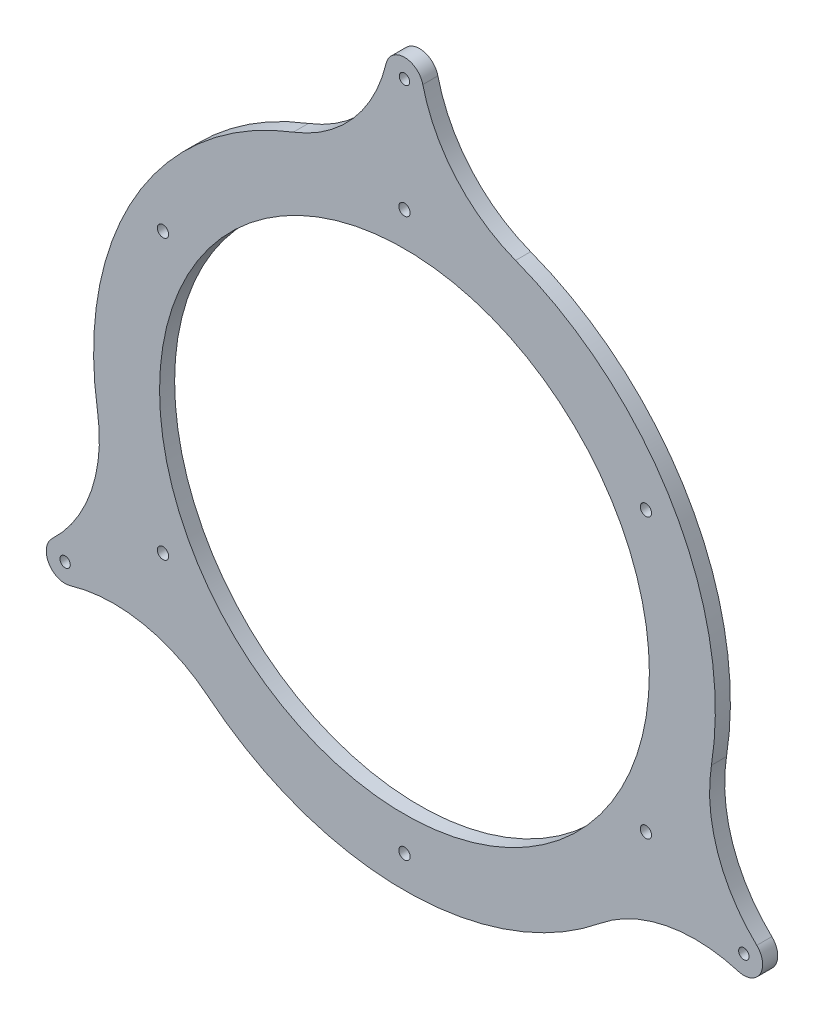
from build123d import *

# Parameters (mm, degrees)
SKETCH1_R           = 1.375
BOSS_EXTRUDE1_DEPTH = 4
SKETCH3_R           = 1.5
SKETCH3_R_2         = 65
CUT_EXTRUDE1_DEPTH  = 145.688169592


with BuildPart() as part:
    # Sketch1 → Boss-Extrude1 (new body)
    with BuildSketch(Plane.XY):
        with BuildLine():
            ThreePointArc((-29.484078319, 77.051535518), (-71.447095812, 41.25), (-81.470626319, -12.991806928))
            ThreePointArc((-81.470626319, -12.991806928), (-83.101535217, -32.169647267), (-93.500519111, -48.365651648))
            ThreePointArc((-93.500519111, -48.365651648), (-94.396769013, -54.5), (-88.636142553, -56.790998993))
            ThreePointArc((-88.636142553, -56.790998993), (-69.410499373, -55.883216958), (-51.986548, -64.05972859))
            ThreePointArc((-51.986548, -64.05972859), (0, -82.5), (51.986548, -64.05972859))
            ThreePointArc((51.986548, -64.05972859), (69.410499373, -55.883216958), (88.636142553, -56.790998993))
            ThreePointArc((88.636142553, -56.790998993), (94.396769013, -54.5), (93.500519111, -48.365651648))
            ThreePointArc((93.500519111, -48.365651648), (83.101535217, -32.169647267), (81.470626319, -12.991806928))
            ThreePointArc((81.470626319, -12.991806928), (71.447095812, 41.25), (29.484078319, 77.051535518))
            ThreePointArc((29.484078319, 77.051535518), (13.691035844, 88.052864225), (4.864376558, 105.156650641))
            ThreePointArc((4.864376558, 105.156650641), (0, 109), (-4.864376558, 105.156650641))
            ThreePointArc((-4.864376558, 105.156650641), (-13.691035844, 88.052864225), (-29.484078319, 77.051535518))
        make_face()
        with Locations((0, 104)):
            Circle(SKETCH1_R, mode=Mode.SUBTRACT)
        with Locations((90.066641994, -52)):
            Circle(SKETCH1_R, mode=Mode.SUBTRACT)
        with Locations((-90.066641994, -52)):
            Circle(SKETCH1_R, mode=Mode.SUBTRACT)
    extrude(amount=BOSS_EXTRUDE1_DEPTH)

    # Sketch3 → Cut-Extrude1 (cut, through all)
    with BuildSketch(Plane.XY.offset(4)):
        with Locations((0, 74)):
            Circle(SKETCH3_R)
        with Locations((-64.08587988, -37)):
            Circle(SKETCH3_R)
        with Locations((64.08587988, -37)):
            Circle(SKETCH3_R)
        with Locations((-64.08587988, 37)):
            Circle(SKETCH3_R)
        with Locations((64.08587988, 37)):
            Circle(SKETCH3_R)
        with Locations((0, -74)):
            Circle(SKETCH3_R)
        Circle(SKETCH3_R_2)
    extrude(amount=-CUT_EXTRUDE1_DEPTH, mode=Mode.SUBTRACT)


solid = part.part
